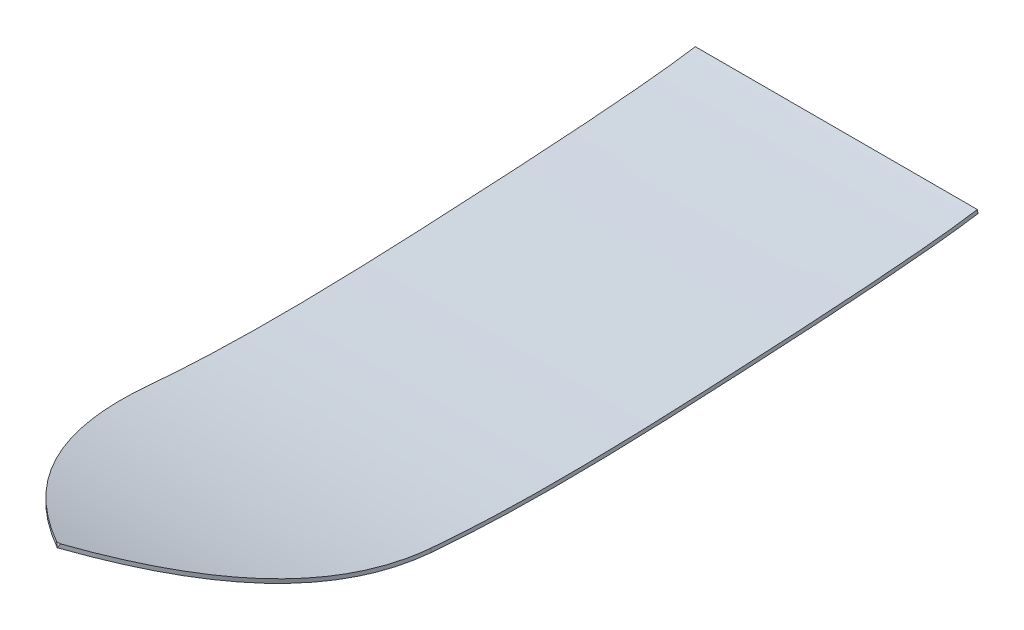
from build123d import *

# Parameters (mm, degrees)
BOSS_EXTRUDE1_DEPTH      = 1524
BOSS_EXTRUDE1_DEPTH_BACK = 1524
CUT_EXTRUDE1_DEPTH       = 2987.22454228
CUT_EXTRUDE1_DEPTH_BACK  = 2987.22454228
SKETCH3_W                = 5731.45735109
SKETCH3_H                = 8003.305882061


with BuildPart() as part:
    # Sketch1 → Boss-Extrude1 (new, two sides: drawn at the far end of the back side and taken through both)
    with BuildSketch(Plane(origin=(0, 0, 0), x_dir=(0, 0, -1), z_dir=(1, 0, 0)).offset(-BOSS_EXTRUDE1_DEPTH_BACK)):
        with BuildLine():
            Line((-2548.047435667, 132.927591344), (-2556.606871514, 109.438528826))
            add(Edge.make_bspline(
                [(-2556.606871514, 109.438528826), (-2548.184617427, 106.369451739), (-2531.31222666, 100.268783876), (-2497.607424359, 88.271929876), (-2455.466347393, 73.626772357), (-2404.861982015, 56.603802648), (-2337.280503664, 34.617419103), (-2252.49660116, 8.428962886), (-2149.918584833, -21.034917967), (-2046.125360422, -48.631371845), (-1905.516135591, -83.028571882), (-1760.722043146, -113.975805249), (-1609.212510431, -141.63626923), (-1491.334048917, -160.754916317), (-1388.6517691, -175.3316128), (-1303.065036003, -186.169456843), (-1236.915219409, -193.876688684), (-1168.483887277, -201.159992134), (-1097.435871492, -208.000395219), (-1024.222612435, -214.308253628), (-923.530549039, -221.975788133), (-791.725653583, -230.082165122), (-623.611244246, -237.195059375), (-445.443353082, -241.482398341), (-257.608004377, -242.814989451), (-61.161026624, -241.198470042), (142.13363627, -236.812056806), (315.27529873, -231.149988291), (454.692006978, -225.67041209), (559.366433541, -221.158871971), (663.848216567, -216.316690887), (767.821609311, -211.21923413), (871.056840968, -205.931213943), (973.213648967, -200.532018745), (1076.482416467, -194.915206822), (1180.107276631, -189.082186291), (1283.716971864, -183.027459433), (1421.217001967, -174.653099897), (1556.841266624, -165.817082015), (1688.764833583, -156.500309995), (1785.399616755, -149.267509281), (1879.269234609, -141.784564291), (1969.917296688, -134.046625801), (2056.888627441, -126.048589111), (2139.729764673, -117.784963117), (2204.946369747, -110.672212846), (2254.605538098, -104.842589349), (2290.537596115, -100.399587961), (2325.102283667, -95.884635298), (2352.721933527, -92.060977587), (2374.079347204, -88.964654487), (2389.724286324, -86.623038087), (2402.436516527, -84.65675956), (2412.427900261, -83.071373476), (2417.329692206, -82.280052371), (2419.79149634, -81.879105942)],
                knots=[0.00450321, 0.00450321, 0.00450321, 0.00450321, 0.012280528, 0.020057847, 0.035612484, 0.051167122, 0.066721759, 0.097831034, 0.128940308, 0.160049583, 0.191158858, 0.253377407, 0.284486682, 0.315595957, 0.346705231, 0.362259869, 0.377814506, 0.393369143, 0.408923781, 0.424478418, 0.440033055, 0.47114233, 0.502251605, 0.533360879, 0.564470154, 0.595579429, 0.626688704, 0.657797978, 0.673352616, 0.688907253, 0.70446189, 0.720016528, 0.735571165, 0.751125802, 0.76668044, 0.782235077, 0.797789714, 0.813344352, 0.844453626, 0.860008264, 0.875562901, 0.891117539, 0.906672176, 0.922226813, 0.937781451, 0.953336088, 0.961113407, 0.968890725, 0.976668044, 0.984445363, 0.988334022, 0.992222681, 0.996111341, 0.99805567, 1, 1, 1, 1], degree=3))
            Line((2419.79149634, -81.879105942), (2415.772774343, -57.204222487))
            add(Edge.make_bspline(
                [(-2548.047435667, 132.927591344), (-2519.18577503, 122.410375831), (-2456.648810348, 100.2300203), (-2360.318626059, 68.066399974), (-2258.682109285, 36.376210485), (-2122.102545456, -3.232442115), (-1983.185671738, -39.069432604), (-1840.128293075, -71.426387016), (-1730.190565959, -94.003113361), (-1635.805337565, -111.438854859), (-1558.209246351, -124.571295103), (-1479.039053441, -137.159935783), (-1376.786562968, -151.876427238), (-1268.901597362, -165.218381343), (-1178.19734975, -175.036777746), (-1119.28076317, -180.813271219), (-1077.066790133, -184.627462081), (-1028.256945918, -188.85156609), (-940.845985817, -195.764699521), (-802.929952279, -204.461212086), (-635.283462535, -211.790542568), (-487.089450864, -215.540020916), (-363.625469846, -217.057400517), (-268.683954653, -217.45008224), (-171.547505124, -217.101696868), (-72.411194497, -216.027580983), (28.487110637, -214.254557865), (130.868414683, -211.821312586), (234.425277258, -208.777192049), (338.822751044, -205.181682645), (443.727148577, -201.100671537), (548.786457244, -196.607054715), (653.701546386, -191.77221073), (758.122324701, -186.674453869), (861.881128208, -181.375111749), (964.454659105, -175.965316793), (1068.076391971, -170.341574353), (1276.153087043, -158.656745058), (1518.886509033, -143.725933966), (1978.336545329, -110.487825044), (2260.001347741, -82.574233241), (2415.772774343, -57.204222487)],
                knots=[0.00450321, 0.00450321, 0.00450321, 0.00450321, 0.03125, 0.0625, 0.09375, 0.125, 0.1875, 0.21875, 0.25, 0.28125, 0.296875, 0.3125, 0.34375, 0.375, 0.390625, 0.40625, 0.4140625, 0.41796875, 0.4375, 0.46875, 0.5, 0.53125, 0.546875, 0.5625, 0.578125, 0.59375, 0.609375, 0.625, 0.640625, 0.65625, 0.671875, 0.6875, 0.703125, 0.71875, 0.734375, 0.75, 0.765625, 0.78125, 0.84375, 0.875, 1, 1, 1, 1], degree=3))
        make_face()
    extrude(amount=BOSS_EXTRUDE1_DEPTH + BOSS_EXTRUDE1_DEPTH_BACK)

    # Sketch3 → Cut-Extrude1 (cut, two sides: drawn at the far end of the back side and taken through both)
    with BuildSketch(Plane(origin=(0, 0, 0), x_dir=(1, 0, 0), z_dir=(0, 1, 0)).offset(-CUT_EXTRUDE1_DEPTH_BACK)):
        with Locations((-68.47307406, 1370.374733043)):
            Rectangle(SKETCH3_W, SKETCH3_H)
        with BuildLine():
            Line((-900, 2444.752421149), (900, 2444.752421149))
            Line((900, 2444.752421149), (900, -1072.781229404))
            add(Edge.make_bspline(
                [(900, -1072.781229404), (900, -1947.419834587), (0, -2556.606871514)],
                knots=[0, 0, 0, 1, 1, 1], degree=2))
            add(Edge.make_bspline(
                [(-900, -1072.781229404), (-900, -1947.419834587), (0, -2556.606871514)],
                knots=[0, 0, 0, 1, 1, 1], degree=2))
            Line((-900, -1072.781229404), (-900, 2444.752421149))
        make_face(mode=Mode.SUBTRACT)
    extrude(amount=CUT_EXTRUDE1_DEPTH + CUT_EXTRUDE1_DEPTH_BACK, mode=Mode.SUBTRACT)


solid = part.part
